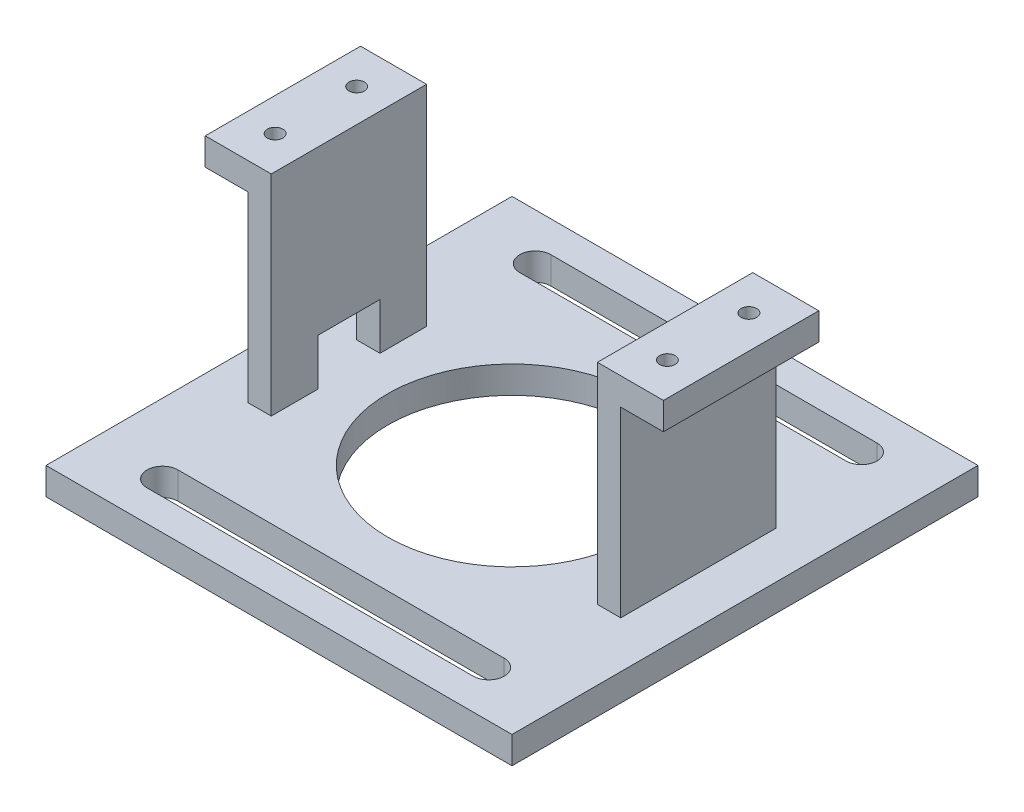
from build123d import *

# Parameters (mm, degrees)
CROQUIS1_W              = 60
CROQUIS1_H              = 60
SALIENTE_EXTRUIR1_DEPTH = 3.5
CROQUIS2_W              = 3
CROQUIS2_H              = 20
SALIENTE_EXTRUIR4_DEPTH = 27
CROQUIS7_R              = 16
CORTAR_EXTRUIR2_DEPTH   = 5
CORTAR_EXTRUIR3_DEPTH   = 5
CROQUIS9_W              = 20
CROQUIS9_H              = 3.5
SALIENTE_EXTRUIR5_DEPTH = 5.5
CROQUIS10_W             = 20
CROQUIS10_H             = 3.5
SALIENTE_EXTRUIR6_DEPTH = 5.5
CROQUIS11_R             = 1
CORTAR_EXTRUIR4_DEPTH   = 5.5
CROQUIS13_R             = 1
CORTAR_EXTRUIR5_DEPTH   = 5.5
CROQUIS14_W             = 8
CROQUIS14_H             = 6
CORTAR_EXTRUIR6_DEPTH   = 10


with BuildPart() as part:
    # Croquis1 → Saliente-Extruir1 (new body)
    with BuildSketch(Plane(origin=(0, 0, 0), x_dir=(1, 0, 0), z_dir=(0, 1, 0))):
        with Locations((-19.589863428, 8.689761392)):
            Rectangle(CROQUIS1_W, CROQUIS1_H)
    extrude(amount=SALIENTE_EXTRUIR1_DEPTH)

    # Croquis2 → Saliente-Extruir4 (add)
    with BuildSketch(Plane(origin=(0, 3.5, 0), x_dir=(1, 0, 0), z_dir=(0, 1, 0))):
        with Locations((2.910136572, 8.689761392)):
            Rectangle(CROQUIS2_W, CROQUIS2_H)
        with Locations((-42.089863428, 8.689761392)):
            Rectangle(CROQUIS2_W, CROQUIS2_H)
    extrude(amount=SALIENTE_EXTRUIR4_DEPTH)

    # Croquis7 → Cortar-Extruir2 (cut)
    with BuildSketch(Plane(origin=(0, 3.5, 0), x_dir=(1, 0, 0), z_dir=(0, 1, 0))):
        with Locations(Location((-19.589863428, 8.689761392, 0), (0, 0, 270))):
            Circle(CROQUIS7_R)
    extrude(amount=-CORTAR_EXTRUIR2_DEPTH, mode=Mode.SUBTRACT)

    # Croquis8 → Cortar-Extruir3 (cut)
    with BuildSketch(Plane(origin=(0, 3.5, 0), x_dir=(1, 0, 0), z_dir=(0, 1, 0))):
        with BuildLine():
            Line((1.410136572, -17.310238608), (-40.589863428, -17.310238608))
            ThreePointArc((-40.589863428, -17.310238608), (-42.589863428, -15.310238608), (-40.589863428, -13.310238608))
            Line((-40.589863428, -13.310238608), (1.410136572, -13.310238608))
            ThreePointArc((1.410136572, -13.310238608), (3.410136572, -15.310238608), (1.410136572, -17.310238608))
        make_face()
        with BuildLine():
            Line((1.410136572, 30.689761392), (-40.589863428, 30.689761392))
            ThreePointArc((-40.589863428, 30.689761392), (-42.589863428, 32.689761392), (-40.589863428, 34.689761392))
            Line((-40.589863428, 34.689761392), (1.410136572, 34.689761392))
            ThreePointArc((1.410136572, 34.689761392), (3.410136572, 32.689761392), (1.410136572, 30.689761392))
        make_face()
    extrude(amount=-CORTAR_EXTRUIR3_DEPTH, mode=Mode.SUBTRACT)

    # Croquis9 → Saliente-Extruir5 (add)
    with BuildSketch(Plane(origin=(4.410136572, 0, 0), x_dir=(0, 0, -1), z_dir=(1, 0, 0))):
        with Locations((8.689761392, 28.75)):
            Rectangle(CROQUIS9_W, CROQUIS9_H)
    extrude(amount=SALIENTE_EXTRUIR5_DEPTH)

    # Croquis10 → Saliente-Extruir6 (add)
    with BuildSketch(Plane.ZY.offset(43.589863428)):
        with Locations((-8.689761392, 28.75)):
            Rectangle(CROQUIS10_W, CROQUIS10_H)
    extrude(amount=SALIENTE_EXTRUIR6_DEPTH)

    # Croquis11 → Cortar-Extruir4 (cut)
    with BuildSketch(Plane(origin=(0, 30.5, 0), x_dir=(1, 0, 0), z_dir=(0, 1, 0))):
        with Locations(Location((-44.839863428, 3.439761392, 0), (0, 0, 270))):
            Circle(CROQUIS11_R)
        with Locations(Location((-44.839863428, 13.939761392, 0), (0, 0, 270))):
            Circle(CROQUIS11_R)
    extrude(amount=-CORTAR_EXTRUIR4_DEPTH, mode=Mode.SUBTRACT)

    # Croquis13 → Cortar-Extruir5 (cut)
    with BuildSketch(Plane(origin=(0, 30.5, 0), x_dir=(1, 0, 0), z_dir=(0, 1, 0))):
        with Locations(Location((5.660136572, 3.439761392, 0), (0, 0, 270))):
            Circle(CROQUIS13_R)
        with Locations(Location((5.660136572, 13.939761392, 0), (0, 0, 270))):
            Circle(CROQUIS13_R)
    extrude(amount=-CORTAR_EXTRUIR5_DEPTH, mode=Mode.SUBTRACT)

    # Croquis14 → Cortar-Extruir6 (cut)
    with BuildSketch(Plane.ZY.offset(43.589863428)):
        with Locations((-8.689761392, 6.5)):
            Rectangle(CROQUIS14_W, CROQUIS14_H)
    extrude(amount=-CORTAR_EXTRUIR6_DEPTH, mode=Mode.SUBTRACT)


solid = part.part
